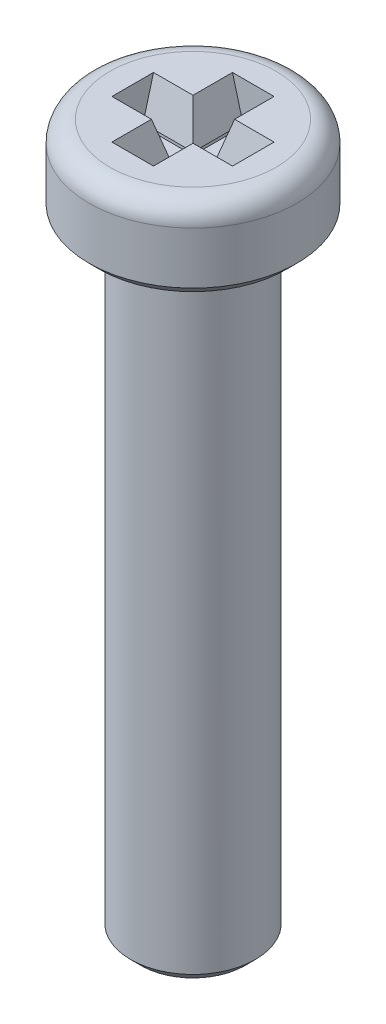
from build123d import *

# Parameters (mm, degrees)
CROQUIS1_R              = 2.5
SALIENTE_EXTRUIR1_DEPTH = 2
CROQUIS2_R              = 1.5
SALIENTE_EXTRUIR2_DEPTH = 15
CHAFL_N1_SIZE           = 0.25
REDONDEO1_R             = 0.5
CORTAR_EXTRUIR1_DEPTH   = 1
CHAFL_N2_SIZE           = 0.25
CHAFL_N2_SIZE2          = 0.933012702


with BuildPart() as part:
    # Croquis1 → Saliente-Extruir1 (new body)
    with BuildSketch(Plane(origin=(0, 0, 0), x_dir=(1, 0, 0), z_dir=(0, 1, 0))):
        with Locations(Location((0, 0, 0), (0, 0, 270))):
            Circle(CROQUIS1_R)
    extrude(amount=SALIENTE_EXTRUIR1_DEPTH)

    # Croquis2 → Saliente-Extruir2 (add)
    with BuildSketch(Plane.XZ):
        with Locations(Location((0, 0, 0), (0, 0, 90))):
            Circle(CROQUIS2_R)
    extrude(amount=SALIENTE_EXTRUIR2_DEPTH)

    # Chaflán1
    chafl_n1_edges = [part.edges().sort_by_distance(p)[0] for p in [
        (0, 0, -2.5),
        (0, -15, -1.5),
    ]]
    chamfer(chafl_n1_edges, length=CHAFL_N1_SIZE)

    # Redondeo1
    redondeo1_edges = [part.edges().sort_by_distance(p)[0] for p in [
        (0, 2, -2.5),
    ]]
    fillet(redondeo1_edges, radius=REDONDEO1_R)

    # Croquis3 → Cortar-Extruir1 (cut)
    with BuildSketch(Plane(origin=(0, 2, 0), x_dir=(1, 0, 0), z_dir=(0, 1, 0))):
        Polygon((0.25, 0.25), (1.45, 0.25), (1.45, -0.25), (0.25, -0.25), (0.25, -1.45), (-0.25, -1.45), (-0.25, -0.25), (-1.45, -0.25), (-1.45, 0.25), (-0.25, 0.25), (-0.25, 1.45), (0.25, 1.45), align=None)
    extrude(amount=-CORTAR_EXTRUIR1_DEPTH, mode=Mode.SUBTRACT)

    # Chaflán2
    chafl_n2_edges = [part.edges().sort_by_distance(p)[0] for p in [
        (-0.25, 2, -0.85),
        (-0.85, 2, -0.25),
        (-0.85, 2, 0.25),
        (-0.25, 2, 0.85),
        (0.25, 2, 0.85),
        (0.85, 2, 0.25),
        (0.85, 2, -0.25),
        (0.25, 2, -0.85),
    ]]
    chafl_n2_side = [part.faces().sort_by_distance(p)[0] for p in [
        (0, 2, -1.943431458),
    ]]
    chamfer(chafl_n2_edges, length=CHAFL_N2_SIZE, length2=CHAFL_N2_SIZE2, reference=chafl_n2_side[0])


solid = part.part
